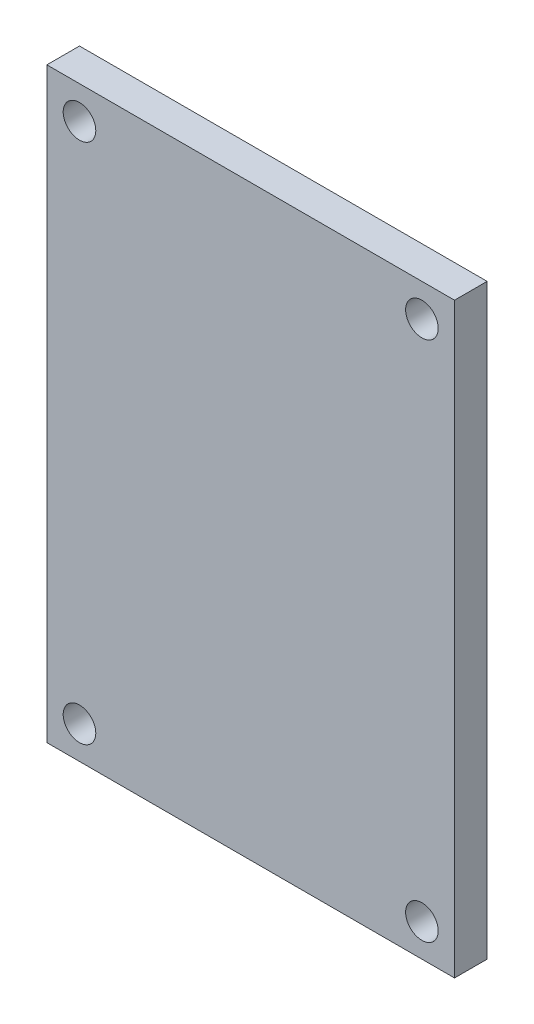
from build123d import *

# Parameters (mm, degrees)
SKETCH1_W           = 25
SKETCH1_H           = 36
SKETCH1_R           = 1
BOSS_EXTRUDE1_DEPTH = 2


with BuildPart() as part:
    # Sketch1 → Boss-Extrude1 (new body)
    with BuildSketch(Plane.XY):
        Rectangle(SKETCH1_W, SKETCH1_H)
        with Locations((-10.5, -16)):
            Circle(SKETCH1_R, mode=Mode.SUBTRACT)
        with Locations((-10.5, 16)):
            Circle(SKETCH1_R, mode=Mode.SUBTRACT)
        with Locations((10.5, 16)):
            Circle(SKETCH1_R, mode=Mode.SUBTRACT)
        with Locations((10.5, -16)):
            Circle(SKETCH1_R, mode=Mode.SUBTRACT)
    extrude(amount=BOSS_EXTRUDE1_DEPTH)


solid = part.part
